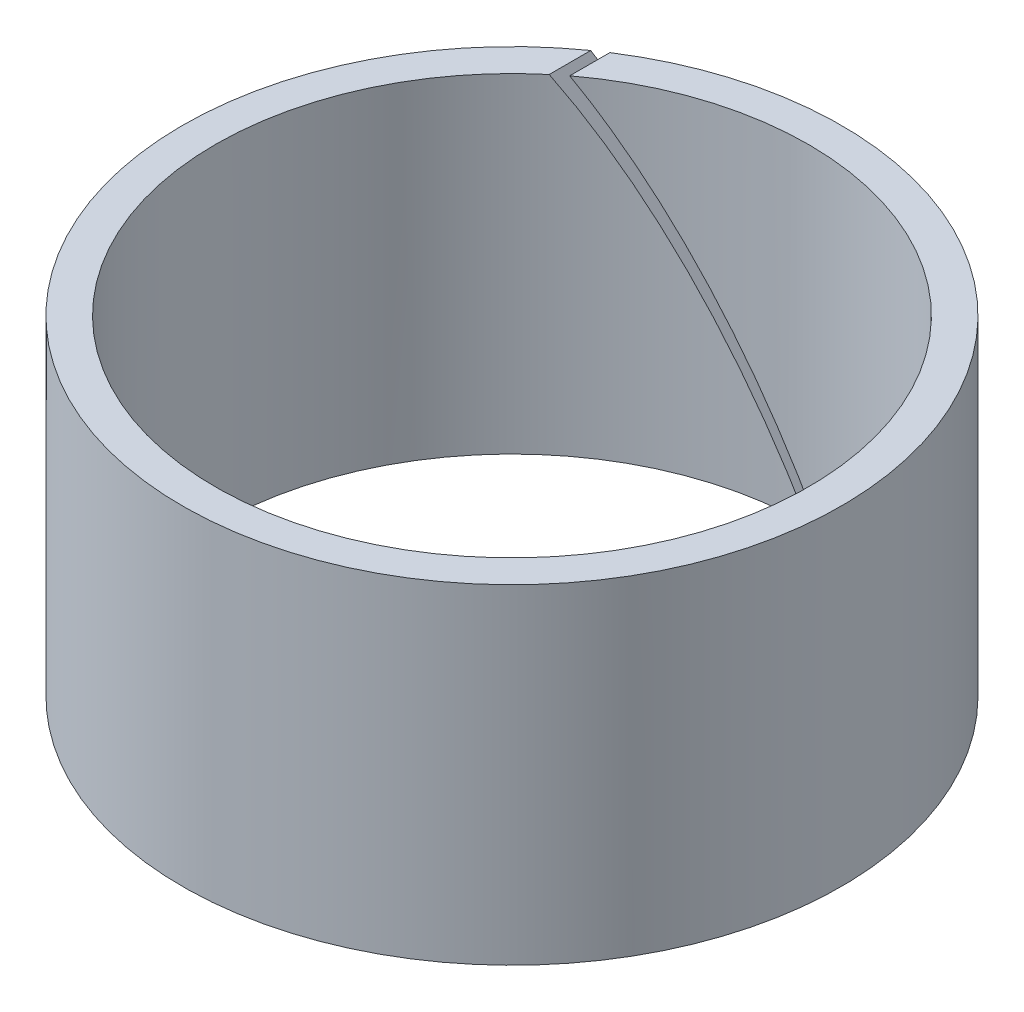
from build123d import *

# Parameters (mm, degrees)
SKETCH1_R           = 10
SKETCH1_R_2         = 9
BOSS_EXTRUDE1_DEPTH = 10
CUT_EXTRUDE1_REACH  = 19.321


with BuildPart() as part:
    # Sketch1 → Boss-Extrude1 (new body)
    with BuildSketch(Plane(origin=(0, 0, 0), x_dir=(1, 0, 0), z_dir=(0, 1, 0))):
        with Locations(Location((0, 0, 0), (0, 0, 270))):
            Circle(SKETCH1_R)
        with Locations(Location((0, 0, 0), (0, 0, 270))):
            Circle(SKETCH1_R_2, mode=Mode.SUBTRACT)
    extrude(amount=BOSS_EXTRUDE1_DEPTH)

    # Sketch3 → Cut-Extrude1 (cut, up to next)
    with BuildSketch(Plane.XY, mode=Mode.PRIVATE) as cut_extrude1_sk1:
        Polygon((0, 0), (-5.773502692, 10), (-5.42709253, 10), (0.346410162, 0), align=None)
    cut_extrude1_tool1 = extrude(cut_extrude1_sk1.sketch, amount=-CUT_EXTRUDE1_REACH, mode=Mode.PRIVATE) & part.part
    add(cut_extrude1_tool1.solids().sort_by_distance((-2.713546, 5, 0))[0], mode=Mode.SUBTRACT)


solid = part.part
